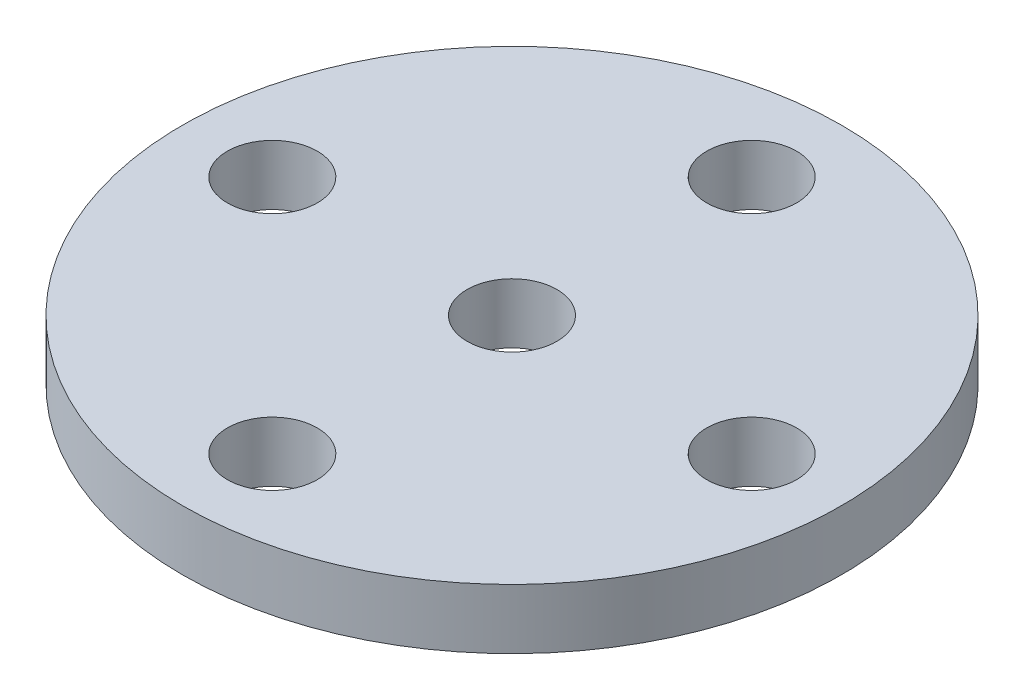
from build123d import *

# Parameters (mm, degrees)
SKETCH_1_R      = 11
SKETCH_1_R_2    = 1.5
EXTRUDE_1_DEPTH = 2


with BuildPart() as part:
    # 草图1 → 凸台-拉伸1 (new body)
    with BuildSketch(Plane(origin=(0, 0, 0), x_dir=(1, 0, 0), z_dir=(0, 1, 0))):
        with Locations(Location((0, 0, 0), (0, 0, 270))):
            Circle(SKETCH_1_R)
        with Locations(Location((0, 8, 0), (0, 0, 270))):
            Circle(SKETCH_1_R_2, mode=Mode.SUBTRACT)
        with Locations(Location((8, 0, 0), (0, 0, 270))):
            Circle(SKETCH_1_R_2, mode=Mode.SUBTRACT)
        with Locations(Location((-8, 0, 0), (0, 0, 90))):
            Circle(SKETCH_1_R_2, mode=Mode.SUBTRACT)
        with Locations(Location((0, -8, 0), (0, 0, 90))):
            Circle(SKETCH_1_R_2, mode=Mode.SUBTRACT)
        with Locations(Location((0, 0, 0), (0, 0, 270))):
            Circle(SKETCH_1_R_2, mode=Mode.SUBTRACT)
    extrude(amount=EXTRUDE_1_DEPTH)


solid = part.part
